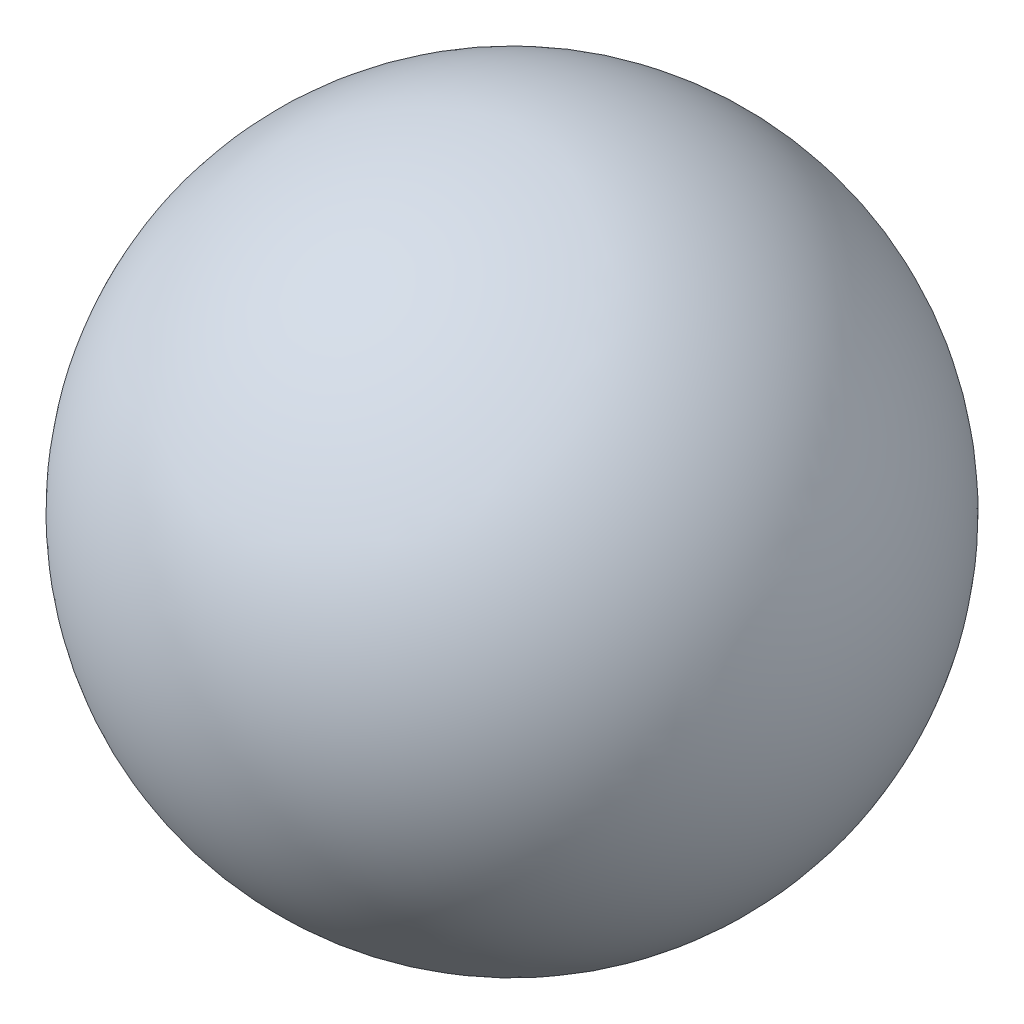
from build123d import *


with BuildPart() as part:
    # Esquisse1 → Base-Révolution (revolve)
    with BuildSketch(Plane(origin=(0, 0, 0), x_dir=(1, 0, 0), z_dir=(0, 1, 0))):
        with BuildLine():
            Line((2.2, 7), (11.8, 7))
            ThreePointArc((11.8, 7), (7, 11.8), (2.2, 7))
        make_face()
    revolve(axis=Axis((-1, 0, -7), (1, 0, 0)))


solid = part.part
